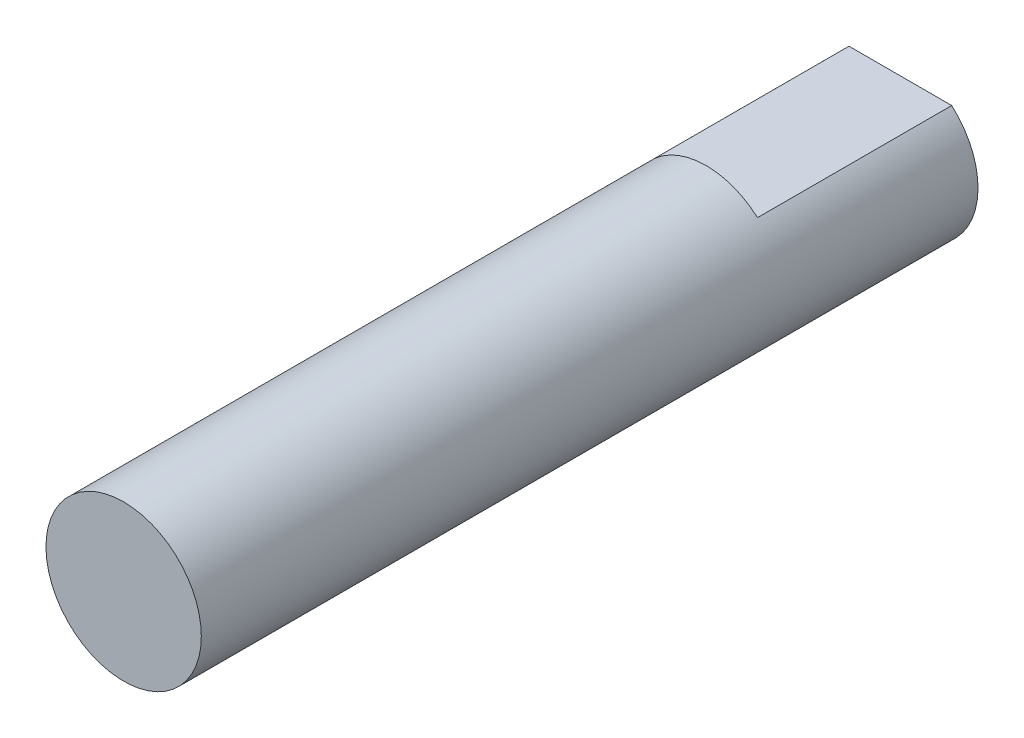
from build123d import *

# Parameters (mm, degrees)
SKETCH_1_R          = 4
EXTRUDE_1_DEPTH     = 40
CUT_EXTRUDE_1_DEPTH = 10


with BuildPart() as part:
    # 스케치1 → 보스-돌출1 (new body)
    with BuildSketch(Plane.XY):
        Circle(SKETCH_1_R)
    extrude(amount=EXTRUDE_1_DEPTH)

    # 스케치2 → 컷-돌출1 (cut)
    with BuildSketch(Plane.XY):
        with BuildLine():
            Line((-2.645751311, 3), (2.645751311, 3))
            ThreePointArc((2.645751311, 3), (0, 4), (-2.645751311, 3))
        make_face()
    extrude(amount=CUT_EXTRUDE_1_DEPTH, mode=Mode.SUBTRACT)


solid = part.part
